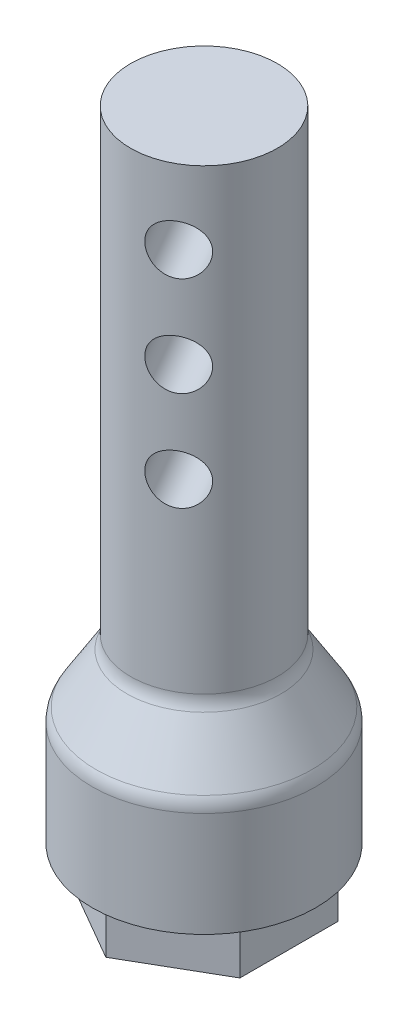
from build123d import *

# Parameters (mm, degrees)
TAGLIO_ESTRUSIONE1_START      = -2
SCHIZZO2_R                    = 4.5
TAGLIO_ESTRUSIONE1_DEPTH      = 2
FORO_FILETTATO_M3X0_5_1_D     = 2.5
FORO_FILETTATO_M3X0_5_1_DEPTH = 9
FORO_FILETTATO_M3X0_5_1_TIP   = 0.751075774
SCHIZZO5_R                    = 1
TAGLIO_ESTRUSIONE2_DEPTH      = 34.021984674


with BuildPart() as part:
    # Schizzo1 → Rivoluzione1 (revolve)
    with BuildSketch(Plane.XY, mode=Mode.PRIVATE) as rivoluzione1_sk:
        with BuildLine():
            Line((0, 0), (4.5, 0))
            Line((4.5, 0), (4.5, 6.215934246))
            ThreePointArc((4.5, 6.215934246), (4.461941718, 6.489188945), (4.350663738, 6.741644436))
            Line((4.350663738, 6.741644436), (3.104336262, 8.758355564))
            ThreePointArc((3.104336262, 8.758355564), (2.993058282, 9.010811055), (2.955, 9.284065754))
            Line((2.955, 9.284065754), (2.955, 31.7))
            Line((2.955, 31.7), (0, 31.7))
            Line((0, 31.7), (0, 0))
        make_face()
    revolve(rivoluzione1_sk.sketch.rotate(Axis((0, 31.7, 0), (0, -1, 0)), 180), axis=Axis((0, 31.7, 0), (0, -1, 0)))

    # Schizzo2 → Taglio-Estrusione1 (cut)
    with BuildSketch(Plane.XZ.offset(TAGLIO_ESTRUSIONE1_START)):
        with Locations(Location((0, 0, 0), (0, 0, 180))):
            Circle(SCHIZZO2_R)
        Polygon((0, 3.95), (-3.420800345, 1.975), (-3.420800345, -1.975), (0, -3.95), (3.420800345, -1.975), (3.420800345, 1.975), align=None, mode=Mode.SUBTRACT)
    extrude(amount=TAGLIO_ESTRUSIONE1_DEPTH, mode=Mode.SUBTRACT)

    # Foro filettato M3x0.5-1
    with Locations(Plane(origin=(0, 0, 0), x_dir=(-1, 0, 0), z_dir=(0, -1, 0))):
        with Locations((0, 0)):
            Hole(FORO_FILETTATO_M3X0_5_1_D / 2, depth=FORO_FILETTATO_M3X0_5_1_DEPTH)
            with Locations((0, 0, -(FORO_FILETTATO_M3X0_5_1_DEPTH + FORO_FILETTATO_M3X0_5_1_TIP / 2))):  # 118° drill point
                Cone(0, FORO_FILETTATO_M3X0_5_1_D / 2, FORO_FILETTATO_M3X0_5_1_TIP, mode=Mode.SUBTRACT)

    # Schizzo5 → Taglio-Estrusione2 (cut, through all)
    with BuildSketch(Plane(origin=(-1.4775, 0, -2.559105068), x_dir=(-0.8660254037844385, 0, 0.5000000000000004), z_dir=(-0.5000000000000003, 0, -0.8660254037844384))):
        with Locations((0, 16.7)):
            Circle(SCHIZZO5_R)
        with Locations((0, 20.7)):
            Circle(SCHIZZO5_R)
        with Locations((0, 24.7)):
            Circle(SCHIZZO5_R)
        with Locations((0, 28.7)):
            Circle(SCHIZZO5_R)
    extrude(amount=-TAGLIO_ESTRUSIONE2_DEPTH, mode=Mode.SUBTRACT)

    # TaglioSuperficie1
    split(bisect_by=Plane(origin=(0, 27.7, 0), x_dir=(1, 0, 0), z_dir=(0, 1, 0)), keep=Keep.BOTTOM)


solid = part.part
